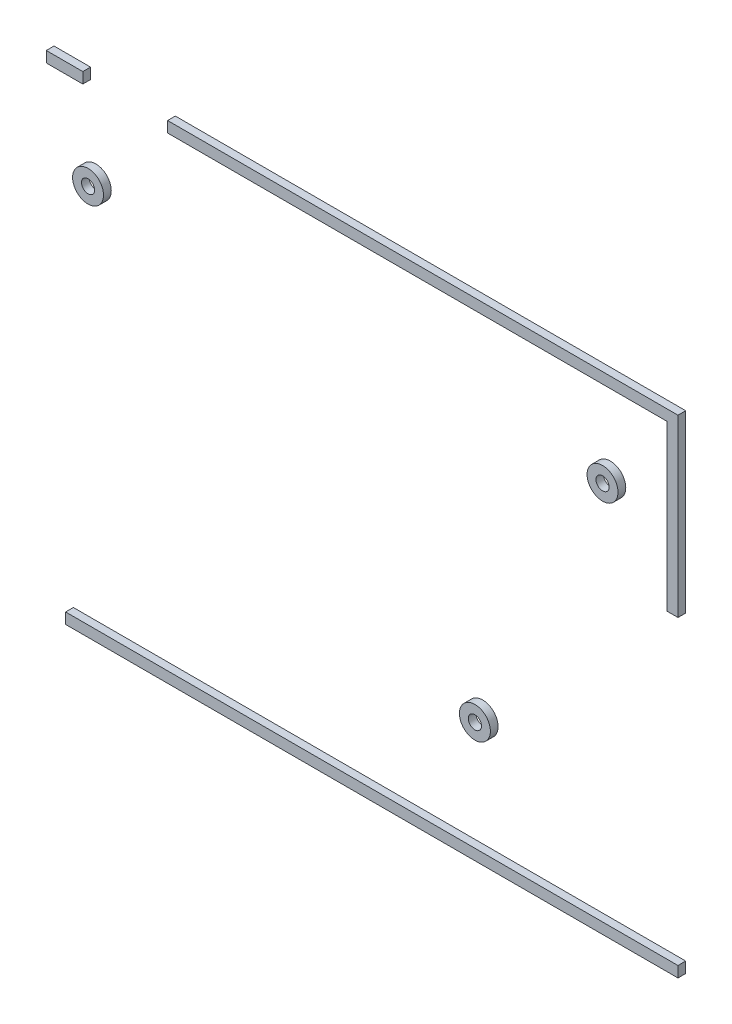
from build123d import *

# Parameters (mm, degrees)
SKETCH1_W           = 129.139207087
SKETCH1_H           = 2.8
SKETCH1_W_2         = 9.439207087
SKETCH1_R           = 4
SKETCH1_R_2         = 1.7
SKETCH1_W_3         = 2.8
SKETCH1_H_2         = 45.3
SKETCH1_W_4         = 158.3
BOSS_EXTRUDE1_DEPTH = 2


with BuildPart() as part:
    # Sketch1 → Boss-Extrude1 (new body)
    # profile 1 of 7: a face of its own
    with BuildSketch(Plane.XY):
        with Locations((108.630396457, 61.6)):
            Rectangle(SKETCH1_W, SKETCH1_H)
    # profile 2 of 7: a face of its own
    with BuildSketch(Plane.XY):
        with Locations((17.419603544, 61.6)):
            Rectangle(SKETCH1_W_2, SKETCH1_H)
    # profile 3 of 7: a face of its own
    with BuildSketch(Plane.XY):
        with Locations((23.5, 38)):
            Circle(SKETCH1_R)
        with Locations((23.5, 38)):
            Circle(SKETCH1_R_2, mode=Mode.SUBTRACT)
    # profile 4 of 7: a face of its own
    with BuildSketch(Plane.XY):
        with Locations((174.6, 40.35)):
            Rectangle(SKETCH1_W_3, SKETCH1_H_2)
    # profile 5 of 7: a face of its own
    with BuildSketch(Plane.XY):
        with Locations((156.5, 38)):
            Circle(SKETCH1_R)
        with Locations((156.5, 38)):
            Circle(SKETCH1_R_2, mode=Mode.SUBTRACT)
    # profile 6 of 7: a face of its own
    with BuildSketch(Plane.XY):
        with Locations((123.5, -32)):
            Circle(SKETCH1_R)
        with Locations((123.5, -32)):
            Circle(SKETCH1_R_2, mode=Mode.SUBTRACT)
    # profile 7 of 7: a face of its own
    with BuildSketch(Plane.XY):
        with Locations((96.85, -61.6)):
            Rectangle(SKETCH1_W_4, SKETCH1_H)
    extrude(amount=BOSS_EXTRUDE1_DEPTH)


solid = part.part
